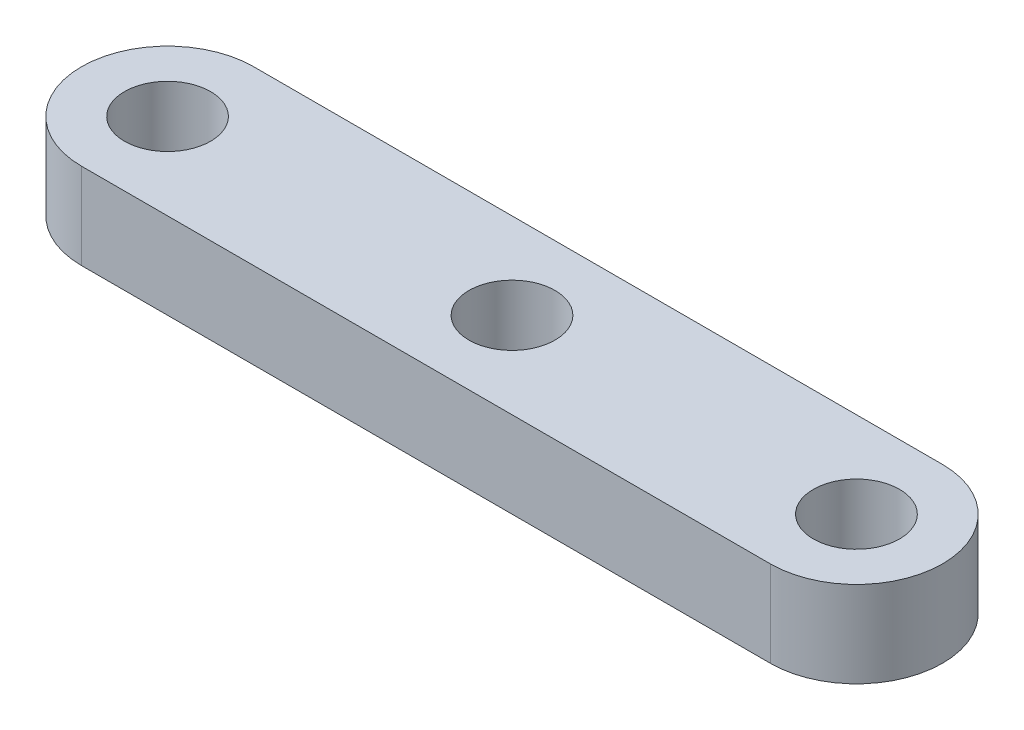
from build123d import *

# Parameters (mm, degrees)
BOSS_EXTRUDE1_DEPTH = 5
SKETCH2_R           = 2.5
CUT_EXTRUDE1_DEPTH  = 26.980762114


with BuildPart() as part:
    # Sketch1 → Boss-Extrude1 (new body)
    with BuildSketch(Plane(origin=(0, 0, 0), x_dir=(1, 0, 0), z_dir=(0, 1, 0))):
        with BuildLine():
            Line((-20, -5), (20, -5))
            ThreePointArc((20, -5), (25, 0), (20, 5))
            Line((20, 5), (-20, 5))
            ThreePointArc((-20, 5), (-25, 0), (-20, -5))
        make_face()
    extrude(amount=BOSS_EXTRUDE1_DEPTH)

    # Sketch2 → Cut-Extrude1 (cut, through all)
    with BuildSketch(Plane(origin=(0, 5, 0), x_dir=(1, 0, 0), z_dir=(0, 1, 0))):
        with Locations(Location((-20, 0, 0), (0, 0, 270))):
            Circle(SKETCH2_R)
        with Locations(Location((20, 0, 0), (0, 0, 270))):
            Circle(SKETCH2_R)
        with Locations(Location((0, 0, 0), (0, 0, 270))):
            Circle(SKETCH2_R)
    extrude(amount=-CUT_EXTRUDE1_DEPTH, mode=Mode.SUBTRACT)


solid = part.part
